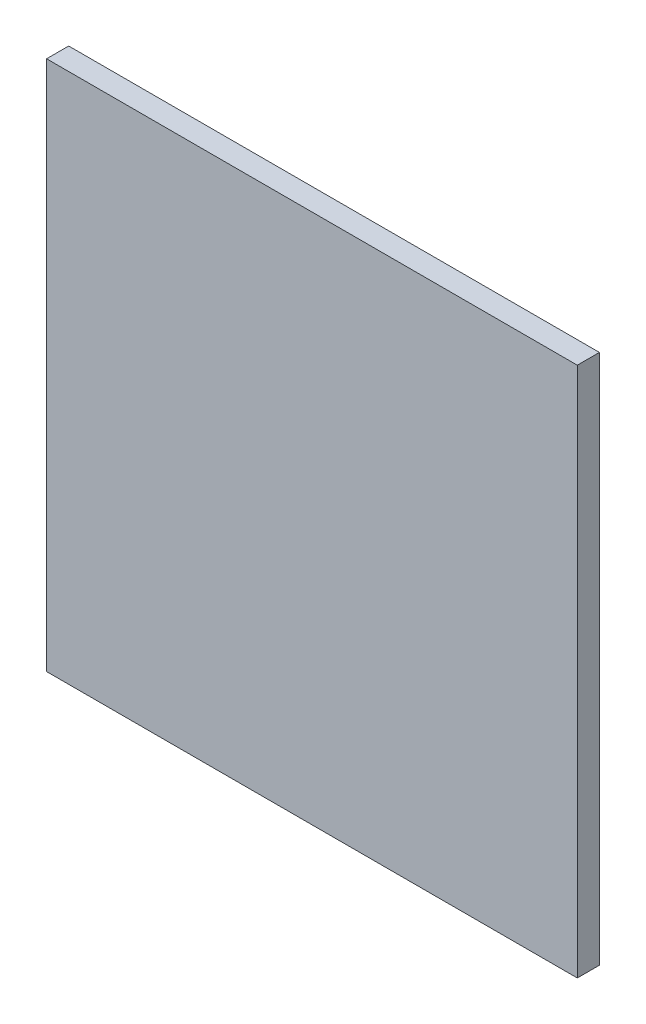
from build123d import *

# Parameters (mm, degrees)
SKETCH1_W           = 60
SKETCH1_H           = 60
BOSS_EXTRUDE1_DEPTH = 2.5


with BuildPart() as part:
    # Sketch1 → Boss-Extrude1 (new body)
    with BuildSketch(Plane.XY):
        Rectangle(SKETCH1_W, SKETCH1_H)
    extrude(amount=BOSS_EXTRUDE1_DEPTH)


solid = part.part
